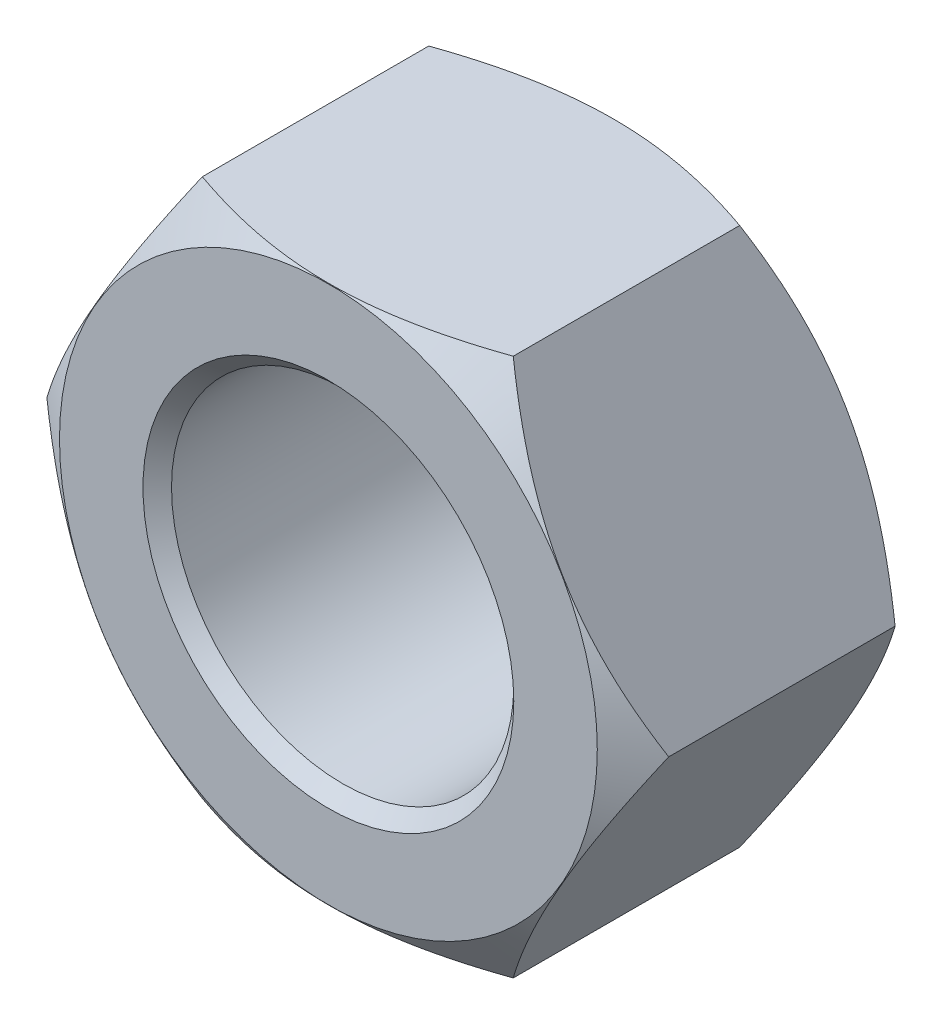
from build123d import *

# Parameters (mm, degrees)
SKETCH1_R           = 3
BOSS_EXTRUDE1_DEPTH = 5
CHAMFER1_SIZE       = 0.25


with BuildPart() as part:
    # Sketch1 → Boss-Extrude1 (new body)
    with BuildSketch(Plane.XY):
        Polygon((5.45, 0), (2.725, 4.719838451), (-2.725, 4.719838451), (-5.45, 0), (-2.725, -4.719838451), (2.725, -4.719838451), align=None)
        Circle(SKETCH1_R, mode=Mode.SUBTRACT)
    extrude(amount=BOSS_EXTRUDE1_DEPTH)

    # Chamfer1
    chamfer1_edges = [part.edges().sort_by_distance(p)[0] for p in [
        (-3, 0, 0),
        (-3, 0, 5),
    ]]
    chamfer(chamfer1_edges, length=CHAMFER1_SIZE)

    # Sketch2 → Cut-Revolve1 (revolve, cut)
    with BuildSketch(Plane(origin=(0, 0, 0), x_dir=(1, 0, 0), z_dir=(0, 1, 0)), mode=Mode.PRIVATE) as cut_revolve1_sk:
        Polygon((-1, -5.5), (-4, -5.5), (-6.14222201, -4), (-6.14222201, -1), (-4, 0.5), (-1, 0.5), (-1, 1.980198167), (-7.750900281, 1.980198167), (-7.750900281, -6.98400312), (-1, -6.98400312), align=None)
    revolve(cut_revolve1_sk.sketch.rotate(Axis((0, 0, 5.5), (0, 0, -1)), 180), axis=Axis((0, 0, 5.5), (0, 0, -1)), mode=Mode.SUBTRACT)


solid = part.part
